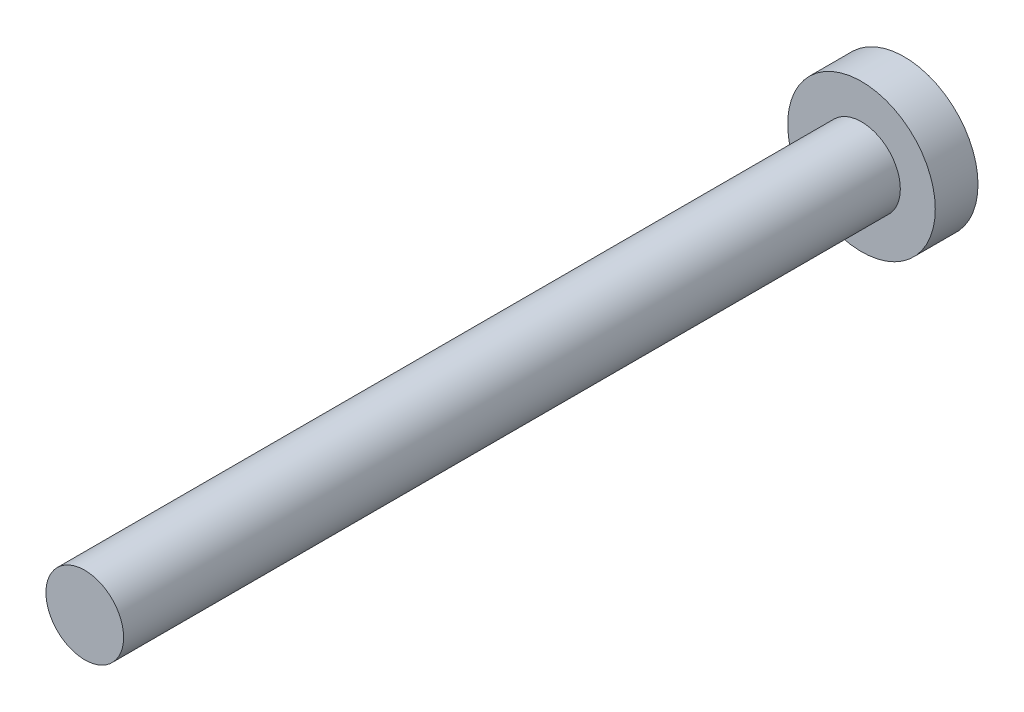
from build123d import *

# Parameters (mm, degrees)
LOW_START                          = -2.2
LOW_HEAD_ENVELOPE_PROFILE_R        = 3.8
LOW_HEAD_ENVELOPE_DEPTH            = 2.2
M4_SHANK_THREADS_OMITTED_PROFILE_R = 2
M4_SHANK_THREADS_OMITTED_DEPTH     = 40


with BuildPart() as part:
    # Low head envelope profile → Low head envelope (new body)
    with BuildSketch(Plane.XY.offset(LOW_START)):
        Circle(LOW_HEAD_ENVELOPE_PROFILE_R)
    extrude(amount=LOW_HEAD_ENVELOPE_DEPTH)

    # M4 shank, threads omitted profile → M4 shank, threads omitted (add)
    with BuildSketch(Plane.XY):
        Circle(M4_SHANK_THREADS_OMITTED_PROFILE_R)
    extrude(amount=M4_SHANK_THREADS_OMITTED_DEPTH)


solid = part.part
